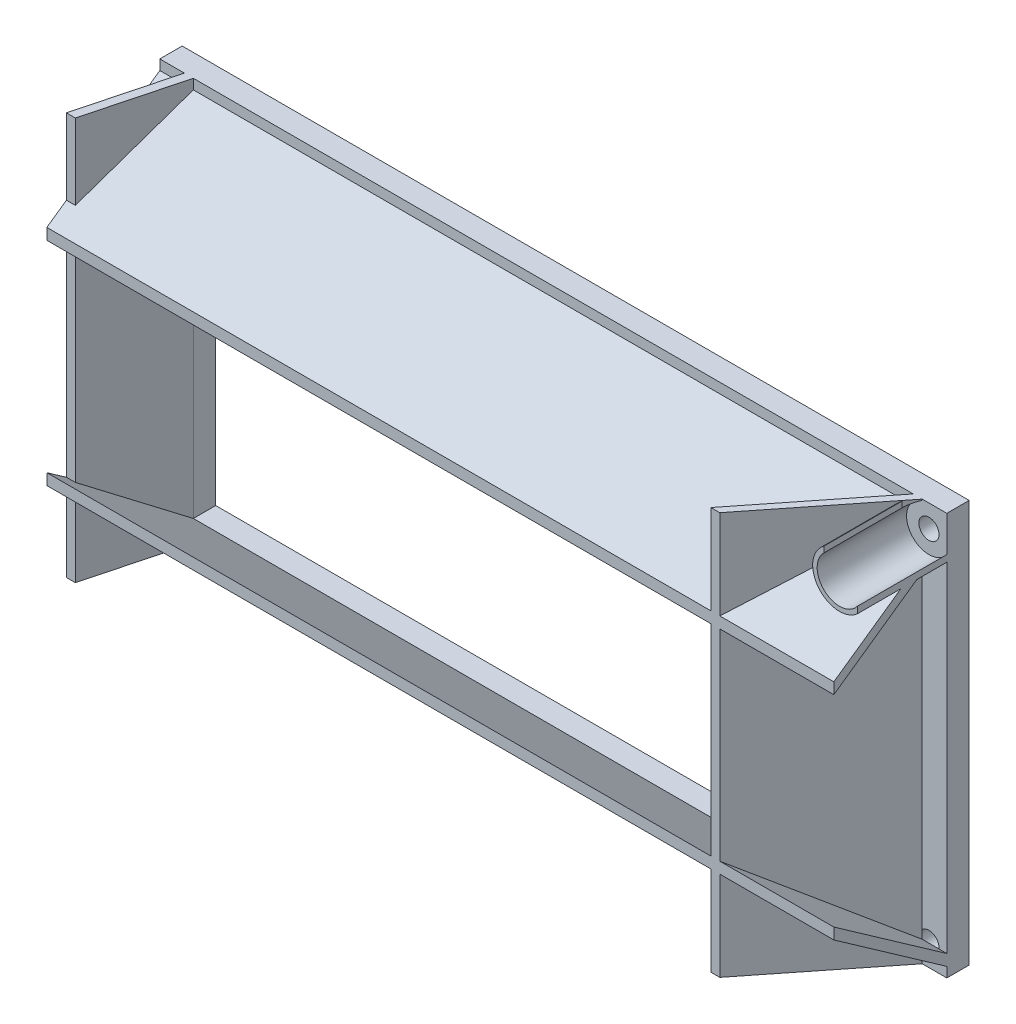
from build123d import *

# Parameters (mm, degrees)
SKETCH1_W            = 176
SKETCH1_H            = 90
SKETCH1_W_2          = 161
SKETCH1_H_2          = 80.5
BOSS_EXTRUDE1_DEPTH  = 5
M4_CLEARANCE_HOLE1_D = 4.5
BOSS_EXTRUDE2_DEPTH  = 90
BOSS_EXTRUDE11_DEPTH = 176
CUT_EXTRUDE1_DEPTH   = 20
BOSS_EXTRUDE12_DEPTH = 20
BOSS_EXTRUDE13_DEPTH = 5


with BuildPart() as part:
    # Sketch1 → Boss-Extrude1 (new body)
    with BuildSketch(Plane.XY):
        Rectangle(SKETCH1_W, SKETCH1_H)
        Rectangle(SKETCH1_W_2, SKETCH1_H_2, mode=Mode.SUBTRACT)
    extrude(amount=BOSS_EXTRUDE1_DEPTH)

    # M4 Clearance Hole1 (through all)
    with Locations(Plane.XY.offset(5)):
        with Locations((84, 40), (-84, -40), (-84, 40), (84, -40)):
            Hole(M4_CLEARANCE_HOLE1_D / 2)

    # Sketch7 → Boss-Extrude2 (add)
    with BuildSketch(Plane(origin=(0, 45, 0), x_dir=(1, 0, 0), z_dir=(0, 1, 0))):
        Polygon((-82.5, -5), (-88, -25.886602241), (-86, -25.886602241), (-80.5, -5), align=None)
        Polygon((80.5, -5), (60.5, -30.264322131), (62.5, -30.264322131), (82.5, -5), align=None)
    extrude(amount=-BOSS_EXTRUDE2_DEPTH)


with BuildPart() as body_2:
    # Sketch8 → Boss-Extrude11 (new body)
    with BuildSketch(Plane(origin=(88, 0, 0), x_dir=(0, 0, -1), z_dir=(1, 0, 0))):
        Polygon((-5, 40.25), (-30.264322131, 22.5), (-30.264322131, 25), (-5, 42.75), align=None)
    extrude(amount=-BOSS_EXTRUDE11_DEPTH)


with BuildPart() as body_3:
    # Mirror2: mirrored copy
    add(body_2.part.mirror(Plane.ZX))


with BuildPart() as body_2_1:
    add(body_2.part)

    # Combine2: union body 3, part
    add(body_3.part)
    add(part.part)

    # Sketch9 → Cut-Extrude1 (cut)
    with BuildSketch(Plane.XY.offset(5)):
        with BuildLine():
            Line((84, 37.75), (84, 35))
            ThreePointArc((84, 35), (86.236067977, 35.527864045), (88, 37))
            Line((88, 37), (88, 40.25))
            Line((88, 40.25), (86.236067977, 40.25))
            ThreePointArc((86.236067977, 40.25), (85.677050983, 38.5), (84, 37.75))
        make_face()
        with BuildLine():
            ThreePointArc((89, 40), (84, 45), (79, 40))
            Line((79, 40), (84, 40))
            Line((84, 40), (84, 37.75))
            ThreePointArc((84, 37.75), (85.677050983, 38.5), (86.236067977, 40.25))
            Line((86.236067977, 40.25), (88, 40.25))
            Line((88, 40.25), (88, 37))
            ThreePointArc((88, 37), (88.74341649, 38.41886117), (89, 40))
        make_face()
        with BuildLine():
            ThreePointArc((79, 40), (79.968871126, 37.041960108), (82.5, 35.230303993))
            Line((82.5, 35.230303993), (82.5, 38.322949017))
            ThreePointArc((82.5, 38.322949017), (83.197150298, 37.898112192), (84, 37.75))
            Line((84, 37.75), (84, 40))
            Line((84, 40), (79, 40))
        make_face()
        with BuildLine():
            Line((82.5, 38.322949017), (82.5, 35.230303993))
            ThreePointArc((82.5, 35.230303993), (83.241211504, 35.057911371), (84, 35))
            Line((84, 35), (84, 37.75))
            ThreePointArc((84, 37.75), (83.197150298, 37.898112192), (82.5, 38.322949017))
        make_face()
    extrude(amount=CUT_EXTRUDE1_DEPTH, mode=Mode.SUBTRACT)

    # Sketch10 → Boss-Extrude12 (add)
    with BuildSketch(Plane.XY.offset(5)):
        with BuildLine():
            Line((88, 35.527864045), (88, 37))
            ThreePointArc((88, 37), (85.531488162, 35.240321018), (82.5, 35.230303993))
            Line((82.5, 35.230303993), (82.5, 34.190524981))
            ThreePointArc((82.5, 34.190524981), (85.417610293, 34.169872981), (88, 35.527864045))
        make_face()
        with BuildLine():
            Line((82.5, 34.190524981), (82.5, 35.230303993))
            ThreePointArc((82.5, 35.230303993), (81.429126737, 35.711572472), (80.5, 36.429285786))
            ThreePointArc((80.5, 36.429285786), (79.343242015, 38.179394313), (79.006253911, 40.25))
            ThreePointArc((79.006253911, 40.25), (79.24786884, 41.554750602), (79.824176728, 42.75))
            Line((79.824176728, 42.75), (78.667317748, 42.75))
            ThreePointArc((78.667317748, 42.75), (78.523911995, 37.547968157), (82.5, 34.190524981))
        make_face()
        with BuildLine():
            ThreePointArc((79.824176728, 42.75), (80.140212612, 43.178370859), (80.5, 43.570714214))
            Line((80.5, 43.570714214), (80.5, 44.873397172))
            ThreePointArc((80.5, 44.873397172), (79.457833906, 43.920296822), (78.667317748, 42.75))
            Line((78.667317748, 42.75), (79.824176728, 42.75))
        make_face()
    extrude(amount=BOSS_EXTRUDE12_DEPTH)

    # Sketch11 → Boss-Extrude13 (add)
    with BuildSketch(Plane.XY.offset(5)):
        with BuildLine():
            Line((80.5, 35.126602828), (80.5, 40.25))
            Line((80.5, 40.25), (78.005210596, 40.25))
            ThreePointArc((78.005210596, 40.25), (78.605553216, 37.373225572), (80.5, 35.126602828))
        make_face()
    extrude(amount=-BOSS_EXTRUDE13_DEPTH)


solid = body_2_1.part
